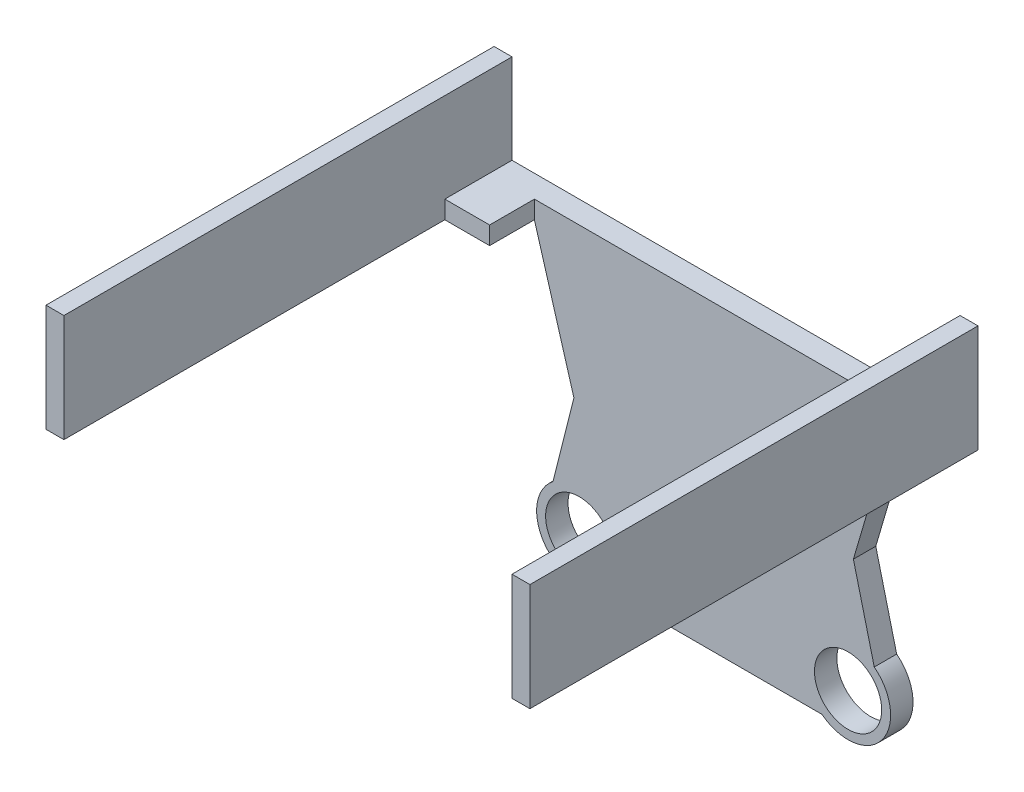
from build123d import *

# Parameters (mm, degrees)
BOSS_EXTRUDE1_DEPTH = 2.5
SKETCH2_W           = 2
SKETCH2_H           = 47.5
BOSS_EXTRUDE2_DEPTH = 12
SKETCH3_W           = 5
SKETCH3_H           = 2
BOSS_EXTRUDE3_DEPTH = 5


with BuildPart() as part:
    # Sketch1 → Boss-Extrude1 (new body)
    with BuildSketch(Plane.XY):
        with BuildLine():
            Line((-20, 215), (-25, 215))
            Line((-25, 215), (-25, 225))
            Line((-25, 225), (-27, 225))
            Line((-27, 225), (-27, 213))
            Line((-27, 213), (-20, 213))
            Line((-20, 213), (-15.594125144, 198))
            Line((-15.594125144, 198), (-17.924730751, 188.7427864))
            ThreePointArc((-17.924730751, 188.7427864), (-18.746396058, 182.079894423), (-12.084524053, 181.25))
            Line((-12.084524053, 181.25), (12.084524053, 181.25))
            ThreePointArc((12.084524053, 181.25), (18.746396058, 182.079894423), (17.924730751, 188.7427864))
            Line((17.924730751, 188.7427864), (15.594125144, 198))
            Line((15.594125144, 198), (20, 213))
            Line((20, 213), (27, 213))
            Line((27, 213), (27, 225))
            Line((27, 225), (25, 225))
            Line((25, 225), (25, 215))
            Line((25, 215), (20, 215))
            Line((20, 215), (-20, 215))
        make_face()
        with BuildLine():
            ThreePointArc((-15, 181.25), (-17.957681098, 182.694653492), (-18.636522555, 185.915534655))
            ThreePointArc((-18.636522555, 185.915534655), (-14.538729788, 188.72152251), (-11.25, 185))
            ThreePointArc((-11.25, 185), (-12.348349571, 182.348349571), (-15, 181.25))
        make_face(mode=Mode.SUBTRACT)
        with BuildLine():
            ThreePointArc((18.75, 185), (17.651650429, 182.348349571), (15, 181.25))
            ThreePointArc((15, 181.25), (12.042318902, 187.305346508), (18.636522555, 185.915534655))
            ThreePointArc((18.636522555, 185.915534655), (18.72152251, 185.461270212), (18.75, 185))
        make_face(mode=Mode.SUBTRACT)
    extrude(amount=BOSS_EXTRUDE1_DEPTH)

    # Sketch2 → Boss-Extrude2 (add)
    with BuildSketch(Plane(origin=(0, 225, 0), x_dir=(1, 0, 0), z_dir=(0, 1, 0))):
        with Locations((26, -26.25)):
            Rectangle(SKETCH2_W, SKETCH2_H)
        with Locations((-26, -26.25)):
            Rectangle(SKETCH2_W, SKETCH2_H)
    extrude(amount=-BOSS_EXTRUDE2_DEPTH)

    # Sketch3 → Boss-Extrude3 (add)
    with BuildSketch(Plane.XY.offset(2.5)):
        with Locations((-22.5, 214)):
            Rectangle(SKETCH3_W, SKETCH3_H)
        with Locations((22.5, 214)):
            Rectangle(SKETCH3_W, SKETCH3_H)
    extrude(amount=BOSS_EXTRUDE3_DEPTH)


solid = part.part
